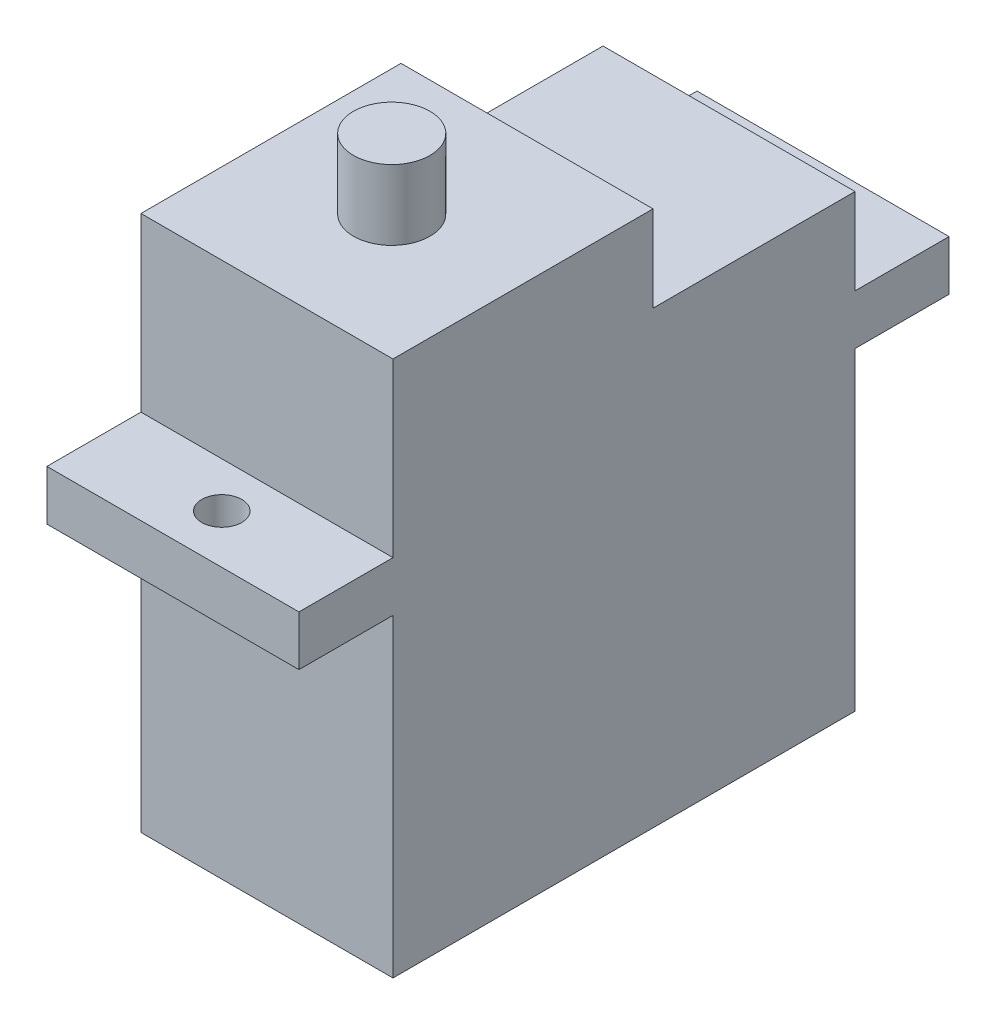
from build123d import *

# Parameters (mm, degrees)
SKETCH2_W           = 12.6
SKETCH2_H           = 23.1
BOSS_EXTRUDE1_DEPTH = 15.7
SKETCH3_W           = 12.6
SKETCH3_H           = 32.5
BOSS_EXTRUDE2_DEPTH = 2.5
SKETCH4_W           = 12.6
SKETCH4_H           = 23.1
BOSS_EXTRUDE3_DEPTH = 4.3
SKETCH5_W           = 12.6
SKETCH5_H           = 13
BOSS_EXTRUDE4_DEPTH = 4.3
SKETCH7_R           = 1.912877934
BOSS_EXTRUDE6_DEPTH = 3.5
SKETCH8_R           = 1
CUT_EXTRUDE1_DEPTH  = 3.5


with BuildPart() as part:
    # Sketch2 → Boss-Extrude1 (new body)
    with BuildSketch(Plane(origin=(0, 0, 0), x_dir=(1, 0, 0), z_dir=(0, 1, 0))):
        Rectangle(SKETCH2_W, SKETCH2_H)
    extrude(amount=BOSS_EXTRUDE1_DEPTH)

    # Sketch3 → Boss-Extrude2 (add)
    with BuildSketch(Plane(origin=(0, 15.7, 0), x_dir=(1, 0, 0), z_dir=(0, 1, 0))):
        Rectangle(SKETCH3_W, SKETCH3_H)
    extrude(amount=BOSS_EXTRUDE2_DEPTH)

    # Sketch4 → Boss-Extrude3 (add)
    with BuildSketch(Plane(origin=(0, 18.2, 0), x_dir=(1, 0, 0), z_dir=(0, 1, 0))):
        Rectangle(SKETCH4_W, SKETCH4_H)
    extrude(amount=BOSS_EXTRUDE3_DEPTH)

    # Sketch5 → Boss-Extrude4 (add)
    with BuildSketch(Plane(origin=(0, 22.5, 0), x_dir=(1, 0, 0), z_dir=(0, 1, 0))):
        with Locations((0, -5.05)):
            Rectangle(SKETCH5_W, SKETCH5_H)
    extrude(amount=BOSS_EXTRUDE4_DEPTH)

    # Sketch7 → Boss-Extrude6 (add)
    with BuildSketch(Plane(origin=(0, 26.8, 0), x_dir=(1, 0, 0), z_dir=(0, 1, 0))):
        with Locations(Location((0, -5.312938635, 0), (0, 0, 90))):
            Circle(SKETCH7_R)
    extrude(amount=BOSS_EXTRUDE6_DEPTH)

    # Sketch8 → Cut-Extrude1 (cut)
    with BuildSketch(Plane(origin=(0, 18.2, 0), x_dir=(1, 0, 0), z_dir=(0, 1, 0))):
        with Locations(Location((0, 13.81, 0), (0, 0, 270))):
            Circle(SKETCH8_R)
        with Locations(Location((0, -13.81, 0), (0, 0, 270))):
            Circle(SKETCH8_R)
    extrude(amount=-CUT_EXTRUDE1_DEPTH, mode=Mode.SUBTRACT)


solid = part.part
